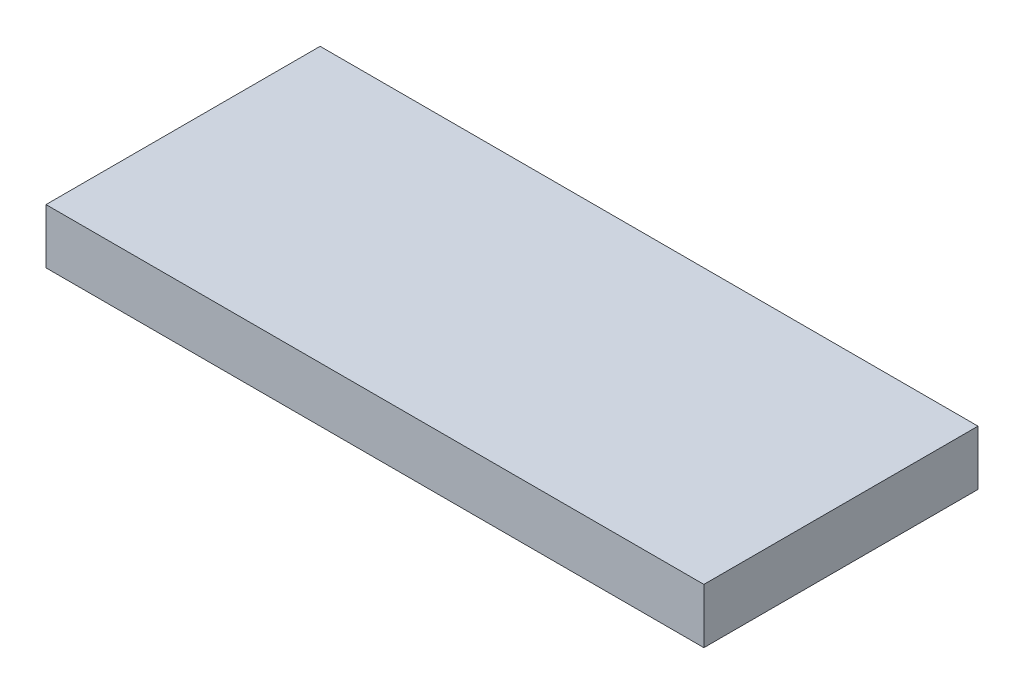
from build123d import *

# Parameters (mm, degrees)
SKETCH1_W           = 120
SKETCH1_H           = 50
BOSS_EXTRUDE1_DEPTH = 10


with BuildPart() as part:
    # Sketch1 → Boss-Extrude1 (new body)
    with BuildSketch(Plane(origin=(0, 0, 0), x_dir=(1, 0, 0), z_dir=(0, 1, 0))):
        Rectangle(SKETCH1_W, SKETCH1_H)
    extrude(amount=BOSS_EXTRUDE1_DEPTH)


solid = part.part
